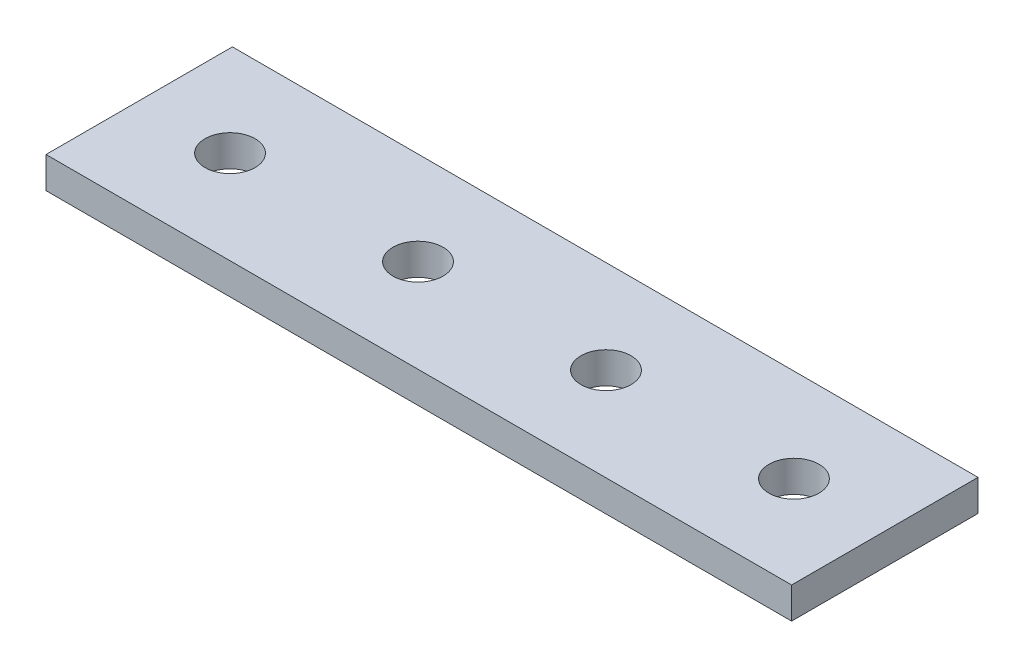
from build123d import *

# Parameters (mm, degrees)
SKETCH1_W                = 47.6
SKETCH1_H                = 5.95
BOSS_EXTRUDE1_DEPTH      = 2
M3_CLEARANCE_HOLE1_D     = 3.2
M3_CLEARANCE_HOLE1_DEPTH = 3


with BuildPart() as part:
    # Sketch1 → Boss-Extrude1 (new body)
    with BuildSketch(Plane(origin=(0, 0, 0), x_dir=(1, 0, 0), z_dir=(0, 1, 0))):
        with Locations((24, 2.975)):
            Rectangle(SKETCH1_W, SKETCH1_H)
        with Locations((24, 8.925)):
            Rectangle(SKETCH1_W, SKETCH1_H)
    extrude(amount=BOSS_EXTRUDE1_DEPTH)

    # M3 Clearance Hole1
    with Locations(Plane(origin=(0, 2, 0), x_dir=(1, 0, 0), z_dir=(0, 1, 0))):
        with Locations((42, 5.95), (30, 5.95), (18, 5.95), (6, 5.95)):
            Hole(M3_CLEARANCE_HOLE1_D / 2, depth=M3_CLEARANCE_HOLE1_DEPTH)


solid = part.part
